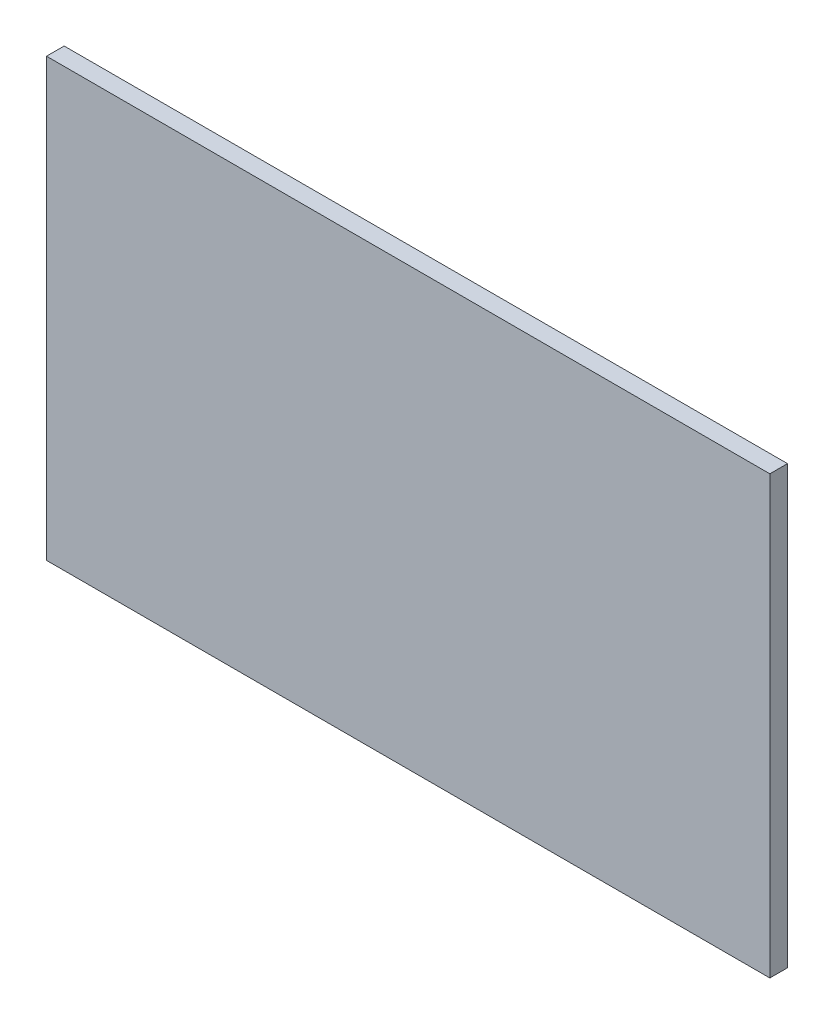
from build123d import *

# Parameters (mm, degrees)
ESQUISSE1_W        = 1640
ESQUISSE1_H        = 990
BOSS_EXTRU_1_DEPTH = 40


with BuildPart() as part:
    # Esquisse1 → Boss.-Extru.1 (new body)
    with BuildSketch(Plane.XY):
        with Locations((820, 495)):
            Rectangle(ESQUISSE1_W, ESQUISSE1_H)
    extrude(amount=BOSS_EXTRU_1_DEPTH)


solid = part.part
